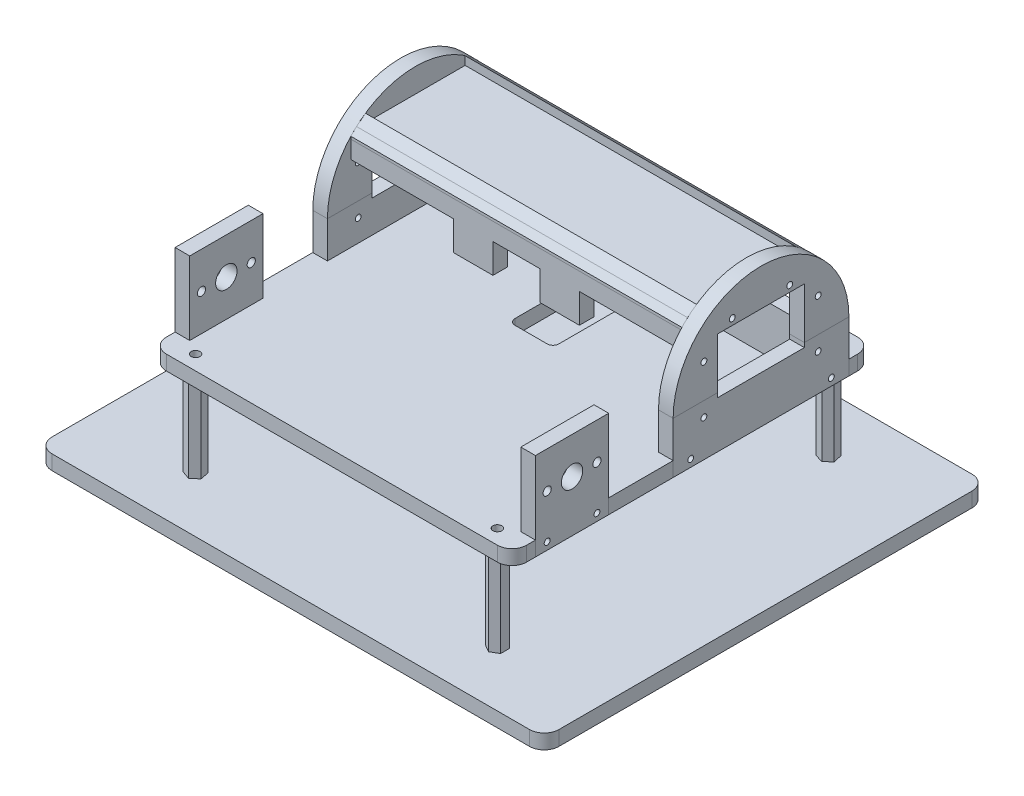
from build123d import *

# Parameters (mm, degrees)
RESSALTO_EXTRUS_O1_DEPTH        = 5
ESBO_O2_W                       = 5
ESBO_O2_H                       = 25
CORTE_EXTRUS_O1_DEPTH           = 5
RESSALTO_EXTRUS_O2_DEPTH        = 25
RESSALTO_EXTRUS_O2_DEPTH_BACK   = 5
ESBO_O4_W                       = 5
ESBO_O4_H                       = 25
RESSALTO_EXTRUS_O2_2_DEPTH      = 25
RESSALTO_EXTRUS_O2_2_DEPTH_BACK = 5
ESBO_O5_R                       = 1
ESBO_O5_R_2                     = 3.65
ESBO_O5_R_3                     = 1.4
CORTE_EXTRUS_O2_DEPTH           = 5
ESBO_O6_R                       = 1
ESBO_O6_R_2                     = 3.65
ESBO_O6_R_3                     = 1.4
CORTE_EXTRUS_O3_DEPTH           = 5
ESBO_O7_W                       = 5
ESBO_O7_H                       = 60
CORTE_EXTRUS_O4_DEPTH           = 5
RESSALTO_EXTRUS_O3_DEPTH        = 12.5
RESSALTO_EXTRUS_O3_DEPTH_BACK   = 5
ESBO_O8_W                       = 5
ESBO_O8_H                       = 60
RESSALTO_EXTRUS_O3_2_DEPTH      = 12.5
RESSALTO_EXTRUS_O3_2_DEPTH_BACK = 5
RESSALTO_EXTRUS_O4_DEPTH        = 5
RESSALTO_EXTRUS_O5_DEPTH        = 5
ESBO_O11_W                      = 29.591
ESBO_O11_H                      = 18.85
CORTE_EXTRUS_O5_DEPTH           = 5
ESBO_O17_W                      = 113
ESBO_O17_H                      = 5
RESSALTO_EXTRUS_O7_DEPTH        = 32
ESBO_O22_W                      = 113
ESBO_O22_H                      = 5
RESSALTO_EXTRUS_O10_DEPTH       = 32
ESBO_O23_W                      = 34
ESBO_O23_H                      = 5
RESSALTO_EXTRUS_O11_DEPTH       = 113
RESSALTO_EXTRUS_O12_DEPTH       = 113
RESSALTO_EXTRUS_O12_2_DEPTH     = 113
CORTE_EXTRUS_O7_DEPTH           = 39
CORTE_EXTRUS_O7_DEPTH_BACK      = 5
ESBO_O25_W                      = 35
ESBO_O25_H                      = 10
CORTE_EXTRUS_O8_DEPTH           = 39
CORTE_EXTRUS_O8_DEPTH_BACK      = 5
ESBO_O26_W                      = 35
ESBO_O26_H                      = 10
ESBO_O27_W                      = 29.6
ESBO_O27_H                      = 18.85
CORTE_EXTRUS_O9_DEPTH           = 5
ESBO_O28_R                      = 1
CORTE_EXTRUS_O10_DEPTH          = 5
ESBO_O29_R                      = 1
CORTE_EXTRUS_O11_DEPTH          = 5
ESBO_O31_R                      = 1.6255
CORTE_EXTRUS_O12_DEPTH          = 10
CORTE_EXTRUS_O13_DEPTH          = 5
ESBO_O33_W                      = 16
ESBO_O33_H                      = 10
CORTE_EXTRUS_O14_DEPTH          = 5
RESSALTO_EXTRUS_O13_DEPTH       = 30
RESSALTO_EXTRUS_O13_2_DEPTH     = 30
RESSALTO_EXTRUS_O13_3_DEPTH     = 30
RESSALTO_EXTRUS_O13_4_DEPTH     = 30
ESBO_O35_R                      = 1.5
RESSALTO_EXTRUS_O14_DEPTH       = 6
RESSALTO_EXTRUS_O14_2_DEPTH     = 6
RESSALTO_EXTRUS_O14_3_DEPTH     = 6
RESSALTO_EXTRUS_O14_4_DEPTH     = 6
ESBO_O36_R                      = 1.5
CORTE_EXTRUS_O15_DEPTH          = 10
RESSALTO_EXTRUS_O15_DEPTH       = 5
ESBO_O40_W                      = 113
ESBO_O40_H                      = 16
CORTE_EXTRUS_O16_DEPTH          = 5


with BuildPart() as part:
    # Esboço1 → Ressalto-extrusão1 (new body)
    with BuildSketch(Plane(origin=(0, 0, 0), x_dir=(1, 0, 0), z_dir=(0, 1, 0))):
        with BuildLine():
            Line((-20.688948469, 116.486662709), (92.311051531, 116.486662709))
            ThreePointArc((92.311051531, 116.486662709), (95.846585437, 115.022196615), (97.311051531, 111.486662709))
            Line((97.311051531, 111.486662709), (97.311051531, -1.513337291))
            ThreePointArc((97.311051531, -1.513337291), (95.846585437, -5.048871197), (92.311051531, -6.513337291))
            Line((92.311051531, -6.513337291), (-20.688948469, -6.513337291))
            ThreePointArc((-20.688948469, -6.513337291), (-24.224482375, -5.048871197), (-25.688948469, -1.513337291))
            Line((-25.688948469, -1.513337291), (-25.688948469, 111.486662709))
            ThreePointArc((-25.688948469, 111.486662709), (-24.224482375, 115.022196615), (-20.688948469, 116.486662709))
        make_face()
    extrude(amount=RESSALTO_EXTRUS_O1_DEPTH)

    # Esboço2 → Corte-extrusão1 (cut)
    with BuildSketch(Plane(origin=(0, 5, 0), x_dir=(1, 0, 0), z_dir=(0, 1, 0))):
        with Locations((94.811051531, 13.986662709)):
            Rectangle(ESBO_O2_W, ESBO_O2_H)
        with Locations((-23.188948469, 13.986662709)):
            Rectangle(ESBO_O2_W, ESBO_O2_H)
    extrude(amount=-CORTE_EXTRUS_O1_DEPTH, mode=Mode.SUBTRACT)

    # Esboço7 → Corte-extrusão4 (cut)
    with BuildSketch(Plane(origin=(0, 5, 0), x_dir=(1, 0, 0), z_dir=(0, 1, 0))):
        with Locations((94.811051531, 78.486662709)):
            Rectangle(ESBO_O7_W, ESBO_O7_H)
        with Locations((-23.188948469, 78.486662709)):
            Rectangle(ESBO_O7_W, ESBO_O7_H)
    extrude(amount=-CORTE_EXTRUS_O4_DEPTH, mode=Mode.SUBTRACT)

    # Esboço32 → Corte-extrusão13 (cut)
    with BuildSketch(Plane.XZ):
        with BuildLine():
            Line((30.311051531, -111.486662709), (41.311051531, -111.486662709))
            ThreePointArc((41.311051531, -111.486662709), (42.725265093, -110.900876271), (43.311051531, -109.486662709))
            Line((43.311051531, -109.486662709), (43.311051531, -63.486662709))
            ThreePointArc((43.311051531, -63.486662709), (42.725265093, -62.072449147), (41.311051531, -61.486662709))
            Line((41.311051531, -61.486662709), (30.311051531, -61.486662709))
            ThreePointArc((30.311051531, -61.486662709), (28.896837969, -62.072449147), (28.311051531, -63.486662709))
            Line((28.311051531, -63.486662709), (28.311051531, -109.486662709))
            ThreePointArc((28.311051531, -109.486662709), (28.896837969, -110.900876271), (30.311051531, -111.486662709))
        make_face()
    extrude(amount=-CORTE_EXTRUS_O13_DEPTH, mode=Mode.SUBTRACT)


with BuildPart() as body_2:
    # Esboço4 → Ressalto-extrusão2 (new, two sides: drawn at the far end of the back side and taken through both)
    with BuildSketch(Plane(origin=(0, 5, 0), x_dir=(1, 0, 0), z_dir=(0, 1, 0)).offset(-RESSALTO_EXTRUS_O2_DEPTH_BACK)):
        with Locations((94.811051531, 13.986662709)):
            Rectangle(ESBO_O4_W, ESBO_O4_H)
    extrude(amount=RESSALTO_EXTRUS_O2_DEPTH + RESSALTO_EXTRUS_O2_DEPTH_BACK)

    # Esboço5 → Corte-extrusão2 (cut)
    with BuildSketch(Plane(origin=(97.311051531, 0, 0), x_dir=(0, 0, -1), z_dir=(1, 0, 0))):
        with Locations((5.486662709, 2.5)):
            Circle(ESBO_O5_R)
        with Locations((22.486662709, 2.5)):
            Circle(ESBO_O5_R)
        with Locations((13.986662709, 17.5)):
            Circle(ESBO_O5_R_2)
        with Locations((5.486662709, 17.5)):
            Circle(ESBO_O5_R_3)
        with Locations((22.486662709, 17.5)):
            Circle(ESBO_O5_R_3)
    extrude(amount=-CORTE_EXTRUS_O2_DEPTH, mode=Mode.SUBTRACT)


with BuildPart() as body_3:
    # Esboço4 → Ressalto-extrus_o2 2 (new, two sides: drawn at the far end of the back side and taken through both)
    with BuildSketch(Plane(origin=(0, 5, 0), x_dir=(1, 0, 0), z_dir=(0, 1, 0)).offset(-RESSALTO_EXTRUS_O2_2_DEPTH_BACK)):
        with Locations((-23.188948469, 13.986662709)):
            Rectangle(ESBO_O4_W, ESBO_O4_H)
    extrude(amount=RESSALTO_EXTRUS_O2_2_DEPTH + RESSALTO_EXTRUS_O2_2_DEPTH_BACK)

    # Esboço6 → Corte-extrusão3 (cut)
    with BuildSketch(Plane.ZY.offset(25.688948469)):
        with Locations((-22.486662709, 2.5)):
            Circle(ESBO_O6_R)
        with Locations((-5.486662709, 2.5)):
            Circle(ESBO_O6_R)
        with Locations((-13.986662709, 17.5)):
            Circle(ESBO_O6_R_2)
        with Locations((-5.486662709, 17.5)):
            Circle(ESBO_O6_R_3)
        with Locations((-22.486662709, 17.5)):
            Circle(ESBO_O6_R_3)
    extrude(amount=-CORTE_EXTRUS_O3_DEPTH, mode=Mode.SUBTRACT)


with BuildPart() as body_4:
    # Esboço8 → Ressalto-extrusão3 (new, two sides: drawn at the far end of the back side and taken through both)
    with BuildSketch(Plane(origin=(0, 5, 0), x_dir=(1, 0, 0), z_dir=(0, 1, 0)).offset(-RESSALTO_EXTRUS_O3_DEPTH_BACK)):
        with Locations((94.811051531, 78.486662709)):
            Rectangle(ESBO_O8_W, ESBO_O8_H)
    extrude(amount=RESSALTO_EXTRUS_O3_DEPTH + RESSALTO_EXTRUS_O3_DEPTH_BACK)


with BuildPart() as body_5:
    # Esboço8 → Ressalto-extrus_o3 2 (new, two sides: drawn at the far end of the back side and taken through both)
    with BuildSketch(Plane(origin=(0, 5, 0), x_dir=(1, 0, 0), z_dir=(0, 1, 0)).offset(-RESSALTO_EXTRUS_O3_2_DEPTH_BACK)):
        with Locations((-23.188948469, 78.486662709)):
            Rectangle(ESBO_O8_W, ESBO_O8_H)
    extrude(amount=RESSALTO_EXTRUS_O3_2_DEPTH + RESSALTO_EXTRUS_O3_2_DEPTH_BACK)


with BuildPart() as body_6:
    # Esboço9 → Ressalto-extrusão4 (new body)
    with BuildSketch(Plane(origin=(97.311051531, 0, 0), x_dir=(0, 0, -1), z_dir=(1, 0, 0))):
        with BuildLine():
            Line((108.486662709, 17.5), (48.486662709, 17.5))
            ThreePointArc((48.486662709, 17.5), (78.486662709, 47.5), (108.486662709, 17.5))
        make_face()
    extrude(amount=-RESSALTO_EXTRUS_O4_DEPTH)


with BuildPart() as body_7:
    # Esboço10 → Ressalto-extrusão5 (new body)
    with BuildSketch(Plane.ZY.offset(25.688948469)):
        with BuildLine():
            Line((-48.486662709, 17.5), (-108.486662709, 17.5))
            ThreePointArc((-108.486662709, 17.5), (-78.486662709, 47.5), (-48.486662709, 17.5))
        make_face()
    extrude(amount=-RESSALTO_EXTRUS_O5_DEPTH)


with BuildPart() as corte_extrus_o5_tool:
    # Esboço11 → Corte-extrusão5 (new body)
    with BuildSketch(Plane.ZY.offset(25.688948469)):
        with Locations((-78.486662709, 25.425)):
            Rectangle(ESBO_O11_W, ESBO_O11_H)
    extrude(amount=-CORTE_EXTRUS_O5_DEPTH)


with BuildPart() as body_5_1:
    add(body_5.part)

    # Corte-extrusão5: cut by corte_extrus_o5_tool
    add(corte_extrus_o5_tool.part, mode=Mode.SUBTRACT)


with BuildPart() as body_7_1:
    add(body_7.part)

    # Corte-extrusão5: cut by corte_extrus_o5_tool
    add(corte_extrus_o5_tool.part, mode=Mode.SUBTRACT)


with BuildPart() as body_8:
    # Esboço17 → Ressalto-extrusão7 (new body)
    with BuildSketch(Plane(origin=(0, 5, 0), x_dir=(1, 0, 0), z_dir=(0, 1, 0))):
        with Locations((35.811051531, 58.986662709)):
            Rectangle(ESBO_O17_W, ESBO_O17_H)
    extrude(amount=RESSALTO_EXTRUS_O7_DEPTH)


with BuildPart() as body_9:
    # Esboço22 → Ressalto-extrusão10 (new body)
    with BuildSketch(Plane(origin=(0, 5, 0), x_dir=(1, 0, 0), z_dir=(0, 1, 0))):
        with Locations((35.811051531, 97.986662709)):
            Rectangle(ESBO_O22_W, ESBO_O22_H)
    extrude(amount=RESSALTO_EXTRUS_O10_DEPTH)


with BuildPart() as body_10:
    # Esboço23 → Ressalto-extrusão11 (new body)
    with BuildSketch(Plane.ZY.offset(-92.311051531)):
        with Locations((-78.486662709, 36.82)):
            Rectangle(ESBO_O23_W, ESBO_O23_H)
    extrude(amount=RESSALTO_EXTRUS_O11_DEPTH)


with BuildPart() as body_11:
    # Esboço24 → Ressalto-extrusão12 (new body)
    with BuildSketch(Plane.ZY.offset(-92.311051531)):
        Polygon((-100.486662709, 37), (-100.486662709, 37.866564726), (-98.561575635, 39.793449061), (-96.117316959, 41.772618951), (-95.486662709, 42.17326521), (-95.486662709, 37), align=None)
    extrude(amount=RESSALTO_EXTRUS_O12_DEPTH)


with BuildPart() as body_12:
    # Esboço24 → Ressalto-extrus_o12 2 (new body)
    with BuildSketch(Plane.ZY.offset(-92.311051531)):
        Polygon((-56.486662709, 37), (-61.486662709, 37), (-61.486662709, 42.17326521), (-58.411749783, 39.793449061), (-56.486662709, 37.868361986), align=None)
    extrude(amount=RESSALTO_EXTRUS_O12_2_DEPTH)


with BuildPart() as corte_extrus_o7_tool:
    # Esboço25 → Corte-extrusão7 (new, two sides: drawn at the far end of the back side and taken through both)
    with BuildSketch(Plane(origin=(0, 0, -61.486662709), x_dir=(-1, 0, 0), z_dir=(0, 0, -1)).offset(-CORTE_EXTRUS_O7_DEPTH_BACK)):
        with Locations((3.188948469, 26)):
            Rectangle(ESBO_O25_W, ESBO_O25_H)
    extrude(amount=CORTE_EXTRUS_O7_DEPTH + CORTE_EXTRUS_O7_DEPTH_BACK)


with BuildPart() as body_8_1:
    add(body_8.part)

    # Corte-extrusão7: cut by corte_extrus_o7_tool
    add(corte_extrus_o7_tool.part, mode=Mode.SUBTRACT)


with BuildPart() as body_9_1:
    add(body_9.part)

    # Corte-extrusão7: cut by corte_extrus_o7_tool
    add(corte_extrus_o7_tool.part, mode=Mode.SUBTRACT)


with BuildPart() as corte_extrus_o8_tool:
    # Esboço26 → Corte-extrusão8 (new, two sides: drawn at the far end of the back side and taken through both)
    with BuildSketch(Plane(origin=(0, 0, -61.486662709), x_dir=(-1, 0, 0), z_dir=(0, 0, -1)).offset(-CORTE_EXTRUS_O8_DEPTH_BACK)):
        with Locations((-74.811051531, 26)):
            Rectangle(ESBO_O26_W, ESBO_O26_H)
    extrude(amount=CORTE_EXTRUS_O8_DEPTH + CORTE_EXTRUS_O8_DEPTH_BACK)


with BuildPart() as body_8_2:
    add(body_8_1.part)

    # Corte-extrusão8: cut by corte_extrus_o8_tool
    add(corte_extrus_o8_tool.part, mode=Mode.SUBTRACT)

    # Esboço33 → Corte-extrusão14 (cut)
    with BuildSketch(Plane.XY.offset(-56.486662709)):
        with Locations((35.811051531, 26)):
            Rectangle(ESBO_O33_W, ESBO_O33_H)
    extrude(amount=-CORTE_EXTRUS_O14_DEPTH, mode=Mode.SUBTRACT)

    # Esboço40 → Corte-extrusão16 (cut)
    with BuildSketch(Plane.XY.offset(-56.486662709)):
        with Locations((35.811051531, 13)):
            Rectangle(ESBO_O40_W, ESBO_O40_H)
    extrude(amount=-CORTE_EXTRUS_O16_DEPTH, mode=Mode.SUBTRACT)


with BuildPart() as body_9_2:
    add(body_9_1.part)

    # Corte-extrusão8: cut by corte_extrus_o8_tool
    add(corte_extrus_o8_tool.part, mode=Mode.SUBTRACT)

    # Esboço31 → Corte-extrusão12 (cut)
    with BuildSketch(Plane(origin=(0, 0, -100.486662709), x_dir=(-1, 0, 0), z_dir=(0, 0, -1))):
        with Locations((-17.141051531, 13)):
            Circle(ESBO_O31_R)
        with Locations((-54.481051531, 13)):
            Circle(ESBO_O31_R)
    extrude(amount=-CORTE_EXTRUS_O12_DEPTH, mode=Mode.SUBTRACT)


with BuildPart() as corte_extrus_o9_tool:
    # Esboço27 → Corte-extrusão9 (new body)
    with BuildSketch(Plane(origin=(97.311051531, 0, 0), x_dir=(0, 0, -1), z_dir=(1, 0, 0))):
        with Locations((78.486662709, 25.425)):
            Rectangle(ESBO_O27_W, ESBO_O27_H)
    extrude(amount=-CORTE_EXTRUS_O9_DEPTH)


with BuildPart() as body_4_1:
    add(body_4.part)

    # Corte-extrusão9: cut by corte_extrus_o9_tool
    add(corte_extrus_o9_tool.part, mode=Mode.SUBTRACT)


with BuildPart() as body_6_1:
    add(body_6.part)

    # Corte-extrusão9: cut by corte_extrus_o9_tool
    add(corte_extrus_o9_tool.part, mode=Mode.SUBTRACT)


with BuildPart() as corte_extrus_o10_tool:
    # Esboço28 → Corte-extrusão10 (new body)
    with BuildSketch(Plane.ZY.offset(25.688948469)):
        with Locations((-97.986662709, 12.5)):
            Circle(ESBO_O28_R)
        with Locations((-97.986662709, 29)):
            Circle(ESBO_O28_R)
        with Locations((-58.986662709, 29)):
            Circle(ESBO_O28_R)
        with Locations((-58.986662709, 12.5)):
            Circle(ESBO_O28_R)
        with Locations((-88.282162709, 37)):
            Circle(ESBO_O28_R)
        with Locations((-68.691162709, 37)):
            Circle(ESBO_O28_R)
        with Locations((-54.486662709, 2.5)):
            Circle(ESBO_O28_R)
        with Locations((-102.486662709, 2.5)):
            Circle(ESBO_O28_R)
    extrude(amount=-CORTE_EXTRUS_O10_DEPTH)


with BuildPart() as body_5_2:
    add(body_5_1.part)

    # Corte-extrusão10: cut by corte_extrus_o10_tool
    add(corte_extrus_o10_tool.part, mode=Mode.SUBTRACT)


with BuildPart() as body_7_2:
    add(body_7_1.part)

    # Corte-extrusão10: cut by corte_extrus_o10_tool
    add(corte_extrus_o10_tool.part, mode=Mode.SUBTRACT)


with BuildPart() as corte_extrus_o11_tool:
    # Esboço29 → Corte-extrusão11 (new body)
    with BuildSketch(Plane(origin=(97.311051531, 0, 0), x_dir=(0, 0, -1), z_dir=(1, 0, 0))):
        with Locations((54.486662709, 2.5)):
            Circle(ESBO_O29_R)
        with Locations((102.486662709, 2.5)):
            Circle(ESBO_O29_R)
        with Locations((58.986662709, 12.5)):
            Circle(ESBO_O29_R)
        with Locations((58.986662709, 29)):
            Circle(ESBO_O29_R)
        with Locations((68.686662709, 37)):
            Circle(ESBO_O29_R)
        with Locations((88.286662709, 37)):
            Circle(ESBO_O29_R)
        with Locations((97.986662709, 29)):
            Circle(ESBO_O29_R)
        with Locations((97.986662709, 12.5)):
            Circle(ESBO_O29_R)
    extrude(amount=-CORTE_EXTRUS_O11_DEPTH)


with BuildPart() as body_4_2:
    add(body_4_1.part)

    # Corte-extrusão11: cut by corte_extrus_o11_tool
    add(corte_extrus_o11_tool.part, mode=Mode.SUBTRACT)


with BuildPart() as body_6_2:
    add(body_6_1.part)

    # Corte-extrusão11: cut by corte_extrus_o11_tool
    add(corte_extrus_o11_tool.part, mode=Mode.SUBTRACT)


with BuildPart() as body_13:
    # Esboço34 → Ressalto-extrusão13 (new body)
    with BuildSketch(Plane.XZ):
        Polygon((87.311051531, 4.513337291), (84.71297532, 3.013337291), (84.71297532, 0.013337291), (87.311051531, -1.486662709), (89.909127742, 0.013337291), (89.909127742, 3.013337291), align=None)
    extrude(amount=RESSALTO_EXTRUS_O13_DEPTH)


with BuildPart() as body_14:
    # Esboço34 → Ressalto-extrus_o13 2 (new body)
    with BuildSketch(Plane.XZ):
        Polygon((-13.420554992, -0.449923017), (-12.85451843, 2.496193514), (-15.122911907, 4.459453821), (-17.957341945, 3.476597599), (-18.523378508, 0.530481068), (-16.254985031, -1.432779239), align=None)
    extrude(amount=RESSALTO_EXTRUS_O13_2_DEPTH)


with BuildPart() as body_15:
    # Esboço34 → Ressalto-extrus_o13 3 (new body)
    with BuildSketch(Plane.XZ):
        Polygon((87.969999913, -108.559926125), (85.10589749, -109.452628379), (84.446949109, -112.379364963), (86.65210315, -114.413399293), (89.516205572, -113.520697039), (90.175153954, -110.593960455), align=None)
    extrude(amount=RESSALTO_EXTRUS_O13_3_DEPTH)


with BuildPart() as body_16:
    # Esboço34 → Ressalto-extrus_o13 4 (new body)
    with BuildSketch(Plane.XZ):
        Polygon((-18.480554249, -110.388055788), (-18.036172861, -113.354960772), (-15.244567081, -114.453567693), (-12.897342688, -112.58526963), (-13.341724077, -109.618364646), (-16.133329857, -108.519757725), align=None)
    extrude(amount=RESSALTO_EXTRUS_O13_4_DEPTH)


with BuildPart() as body_17:
    # Esboço35 → Ressalto-extrusão14 (new body)
    with BuildSketch(Plane.XZ.offset(30)):
        with Locations((87.278117348, -111.624182303)):
            Circle(ESBO_O35_R)
    extrude(amount=RESSALTO_EXTRUS_O14_DEPTH)


with BuildPart() as body_18:
    # Esboço35 → Ressalto-extrus_o14 2 (new body)
    with BuildSketch(Plane.XZ.offset(30)):
        with Locations((-15.705941855, -111.624182303)):
            Circle(ESBO_O35_R)
    extrude(amount=RESSALTO_EXTRUS_O14_2_DEPTH)


with BuildPart() as body_19:
    # Esboço35 → Ressalto-extrus_o14 3 (new body)
    with BuildSketch(Plane.XZ.offset(30)):
        with Locations((-15.705941855, 1.457424581)):
            Circle(ESBO_O35_R)
    extrude(amount=RESSALTO_EXTRUS_O14_3_DEPTH)


with BuildPart() as body_20:
    # Esboço35 → Ressalto-extrus_o14 4 (new body)
    with BuildSketch(Plane.XZ.offset(30)):
        with Locations((87.278117348, 1.457424581)):
            Circle(ESBO_O35_R)
    extrude(amount=RESSALTO_EXTRUS_O14_4_DEPTH)


with BuildPart() as corte_extrus_o15_tool:
    # Esboço36 → Corte-extrusão15 (new body)
    with BuildSketch(Plane(origin=(0, 5, 0), x_dir=(1, 0, 0), z_dir=(0, 1, 0))):
        with Locations((87.311051531, -1.513337291)):
            Circle(ESBO_O36_R)
        with Locations((-15.688948469, -1.513337291)):
            Circle(ESBO_O36_R)
        with Locations((-15.688948469, 111.486662709)):
            Circle(ESBO_O36_R)
        with Locations((87.311051531, 111.486662709)):
            Circle(ESBO_O36_R)
    extrude(amount=-CORTE_EXTRUS_O15_DEPTH)


with BuildPart() as part_1:
    add(part.part)

    # Corte-extrusão15: cut by corte_extrus_o15_tool
    add(corte_extrus_o15_tool.part, mode=Mode.SUBTRACT)


with BuildPart() as body_13_1:
    add(body_13.part)

    # Corte-extrusão15: cut by corte_extrus_o15_tool
    add(corte_extrus_o15_tool.part, mode=Mode.SUBTRACT)


with BuildPart() as body_14_1:
    add(body_14.part)

    # Corte-extrusão15: cut by corte_extrus_o15_tool
    add(corte_extrus_o15_tool.part, mode=Mode.SUBTRACT)


with BuildPart() as body_15_1:
    add(body_15.part)

    # Corte-extrusão15: cut by corte_extrus_o15_tool
    add(corte_extrus_o15_tool.part, mode=Mode.SUBTRACT)


with BuildPart() as body_16_1:
    add(body_16.part)

    # Corte-extrusão15: cut by corte_extrus_o15_tool
    add(corte_extrus_o15_tool.part, mode=Mode.SUBTRACT)


with BuildPart() as body_21:
    # Esboço38 → Ressalto-extrusão15 (new body)
    with BuildSketch(Plane.XZ.offset(30)):
        with BuildLine():
            Line((-45.688948469, 20.513337291), (117.311051531, 20.513337291))
            ThreePointArc((117.311051531, 20.513337291), (120.846585437, 19.048871197), (122.311051531, 15.513337291))
            Line((122.311051531, 15.513337291), (122.311051531, -125.486662709))
            ThreePointArc((122.311051531, -125.486662709), (120.846585437, -129.022196615), (117.311051531, -130.486662709))
            Line((117.311051531, -130.486662709), (-45.688948469, -130.486662709))
            ThreePointArc((-45.688948469, -130.486662709), (-49.224482375, -129.022196615), (-50.688948469, -125.486662709))
            Line((-50.688948469, -125.486662709), (-50.688948469, 15.513337291))
            ThreePointArc((-50.688948469, 15.513337291), (-49.224482375, 19.048871197), (-45.688948469, 20.513337291))
        make_face()
    extrude(amount=RESSALTO_EXTRUS_O15_DEPTH)


solid = Compound([body_2.part, body_3.part, body_10.part, body_11.part, body_12.part, body_8_2.part, body_9_2.part, body_5_2.part, body_7_2.part, body_4_2.part, body_6_2.part, body_17.part, body_18.part, body_19.part, body_20.part, part_1.part, body_13_1.part, body_14_1.part, body_15_1.part, body_16_1.part, body_21.part])
